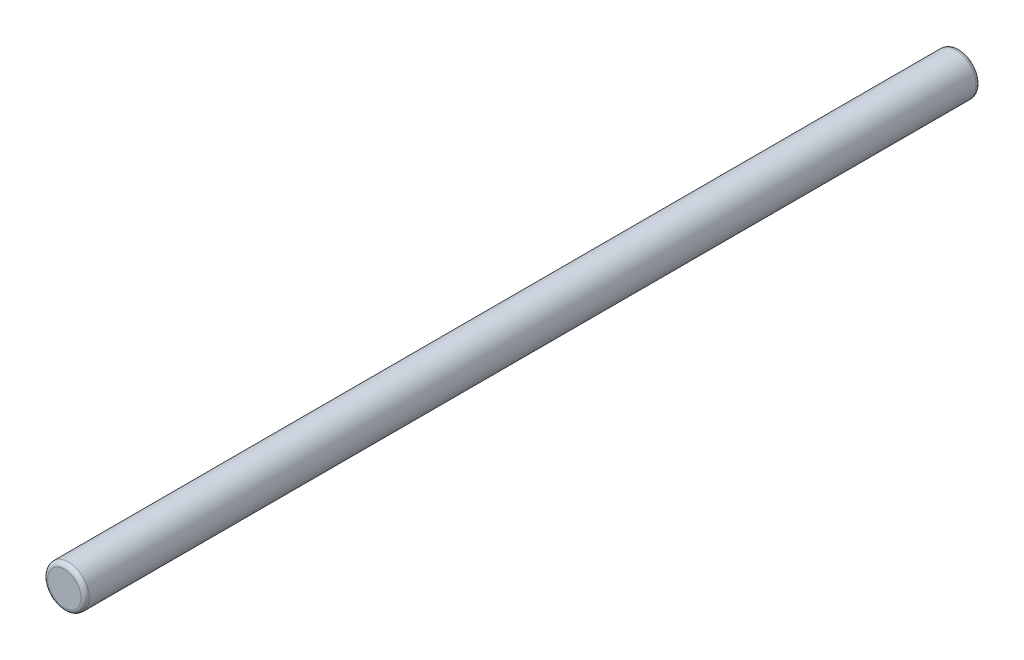
from build123d import *

# Parameters (mm, degrees)
SKETCH_1_R      = 1
EXTRUDE_1_DEPTH = 43
FILLET_1_R      = 0.2


with BuildPart() as part:
    # Эскиз1 → Бобышка-Вытянуть1 (new body)
    with BuildSketch(Plane.XY):
        Circle(SKETCH_1_R)
    extrude(amount=EXTRUDE_1_DEPTH)

    # Скругление1
    fillet_1_edges = [part.edges().sort_by_distance(p)[0] for p in [
        (-1, 0, 0),
        (-1, 0, 43),
    ]]
    fillet(fillet_1_edges, radius=FILLET_1_R)


solid = part.part
